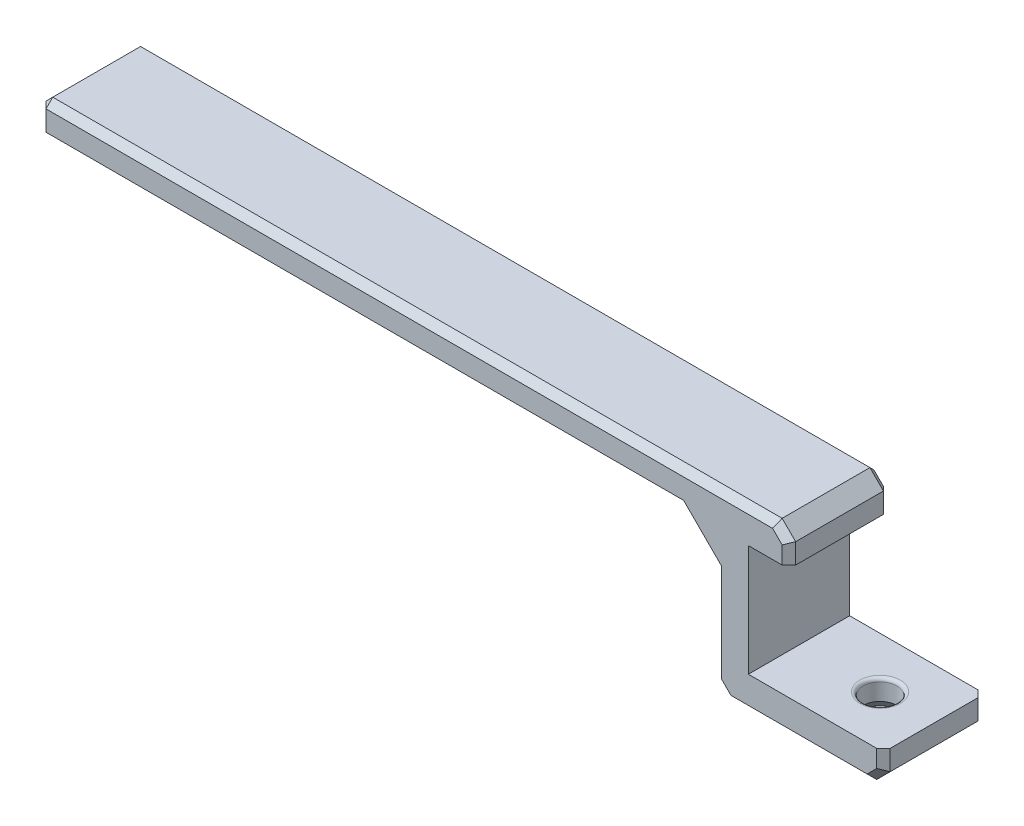
from build123d import *

# Parameters (mm, degrees)
RESSALTO_EXTRUS_O1_DEPTH = 15
ESBO_O3_R                = 2.5
CORTE_EXTRUS_O1_DEPTH    = 15
CHANFRO1_SIZE            = 2
FILETE1_R                = 0.5
CHANFRO5_SIZE            = 2
CHANFRO7_SIZE            = 5
CHANFRO9_SIZE            = 1
CORTE_EXTRUS_O2_DEPTH    = 5


with BuildPart() as part:
    # Esboço1 → Ressalto-extrusão1 (new body)
    with BuildSketch(Plane.XY):
        Polygon((0.299414955, -0.75), (-5.700585045, -0.75), (-5.700585045, -17.25), (14.299414955, -17.25), (14.299414955, -22.25), (-10.700585045, -22.25), (-10.700585045, -0.75), (-110.700585045, -0.75), (-110.700585045, 4.25), (0.299414955, 4.25), align=None)
    extrude(amount=RESSALTO_EXTRUS_O1_DEPTH)

    # Esboço3 → Corte-extrusão1 (cut)
    with BuildSketch(Plane.XZ.offset(22.25)):
        with Locations(Location((6.299414955, 7.5, 0), (0, 0, 270))):
            Circle(ESBO_O3_R)
    extrude(amount=-CORTE_EXTRUS_O1_DEPTH, mode=Mode.SUBTRACT)

    # Chanfro1
    chanfro1_edges = [part.edges().sort_by_distance(p)[0] for p in [
        (6.299414955, -22.25, 10),
    ]]
    chamfer(chanfro1_edges, length=CHANFRO1_SIZE)

    # Filete1
    filete1_edges = [part.edges().sort_by_distance(p)[0] for p in [
        (6.299414955, -17.25, 10),
    ]]
    fillet(filete1_edges, radius=FILETE1_R)

    # Chanfro5
    chanfro5_edges = [part.edges().sort_by_distance(p)[0] for p in [
        (14.299414955, -22.25, 7.5),
        (-10.700585045, -22.25, 7.5),
        (0.299414955, 4.25, 7.5),
    ]]
    chamfer(chanfro5_edges, length=CHANFRO5_SIZE)

    # Chanfro7
    chanfro7_edges = [part.edges().sort_by_distance(p)[0] for p in [
        (-10.700585045, -0.75, 7.5),
    ]]
    chamfer(chanfro7_edges, length=CHANFRO7_SIZE)

    # Chanfro9
    chanfro9_edges = [part.edges().sort_by_distance(p)[0] for p in [
        (13.299414955, -21.25, 0),
        (14.299414955, -18.75, 0),
        (0.299414955, 0.75, 0),
        (-0.700585045, 3.25, 0),
        (-56.200585045, 4.25, 0),
        (-110.700585045, 1.75, 0),
        (-63.200585045, -0.75, 0),
        (-13.200585045, -3.25, 0),
        (-10.700585045, -13, 0),
        (-9.700585045, -21.25, 0),
        (1.799414955, -22.25, 0),
        (-110.700585045, 1.75, 15),
        (-56.200585045, 4.25, 15),
        (-0.700585045, 3.25, 15),
        (0.299414955, 0.75, 15),
        (14.299414955, -18.75, 15),
        (13.299414955, -21.25, 15),
        (1.799414955, -22.25, 15),
        (-9.700585045, -21.25, 15),
        (-10.700585045, -13, 15),
        (-13.200585045, -3.25, 15),
        (-63.200585045, -0.75, 15),
        (-110.700585045, 4.25, 7.5),
        (-110.700585045, -0.75, 7.5),
    ]]
    chamfer(chanfro9_edges, length=CHANFRO9_SIZE)

    # Esboço4 → Corte-extrusão2 (cut)
    with BuildSketch(Plane(origin=(0, -10.75, 0), x_dir=(1, 0, 0), z_dir=(0, 0, -1))):
        with BuildLine():
            Line((-104.993478264, -11.6), (-19.993478264, -11.6))
            ThreePointArc((-19.993478264, -11.6), (-19.093478264, -12.5), (-19.993478264, -13.4))
            Line((-19.993478264, -13.4), (-104.993478264, -13.4))
            ThreePointArc((-104.993478264, -13.4), (-105.893478264, -12.5), (-104.993478264, -11.6))
        make_face()
    extrude(amount=-CORTE_EXTRUS_O2_DEPTH, mode=Mode.SUBTRACT)


solid = part.part
